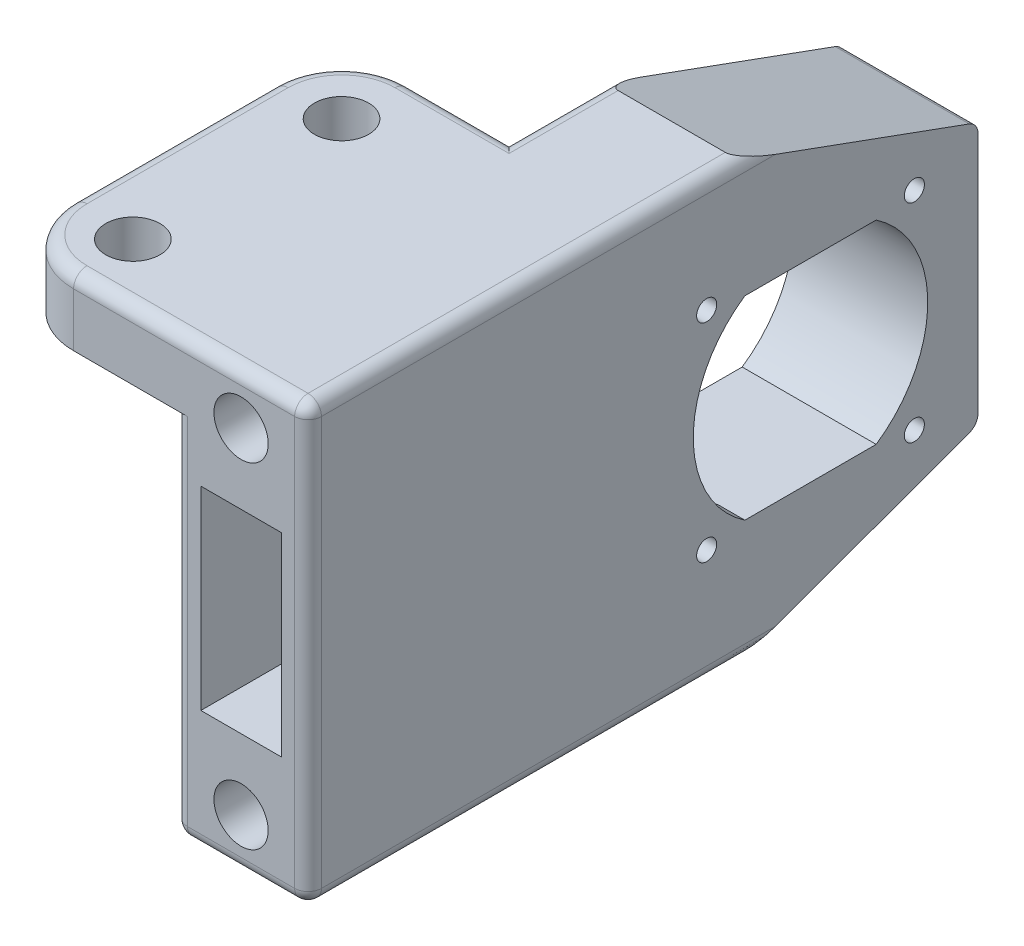
from build123d import *

# Parameters (mm, degrees)
SKETCH2_R               = 10
BOSS_EXTRUDE1_DEPTH     = 65
BOSS_EXTRUDE2_DEPTH     = 10
BOSS_EXTRUDE3_DEPTH     = 65
FILLET1_R               = 10
SKETCH5_R               = 4.05
CUT_EXTRUDE1_DEPTH      = 78.781745931
BOSS_EXTRUDE4_DEPTH     = 65
SKETCH8_R               = 4.05
CUT_EXTRUDE3_DEPTH      = 50
CUT_EXTRUDE5_DEPTH      = 92.923881554
CUT_EXTRUDE6_REACH      = 126.298
CUT_EXTRUDE6_END_RADIUS = 17.5
SKETCH7_W               = 12
SKETCH7_H               = 29
CHAMFER1_SIZE           = 13
CHAMFER1_SIZE2          = 35.717206453
FILLET2_R               = 2
SKETCH14_R              = 1.5
CUT_EXTRUDE7_DEPTH      = 100.247166206


with BuildPart() as part:
    # Sketch2 → Boss-Extrude1 (new body)
    with BuildSketch(Plane(origin=(0, 0, 0), x_dir=(1, 0, 0), z_dir=(0, 1, 0))):
        with Locations(Location((0, 0, 0), (0, 0, 270))):
            Circle(SKETCH2_R)
    extrude(amount=-BOSS_EXTRUDE1_DEPTH)

    # Sketch3 → Boss-Extrude2 (add)
    with BuildSketch(Plane(origin=(0, 0, 0), x_dir=(1, 0, 0), z_dir=(0, 1, 0))):
        with BuildLine():
            Line((-10, 0), (-10, -40))
            Line((-10, -40), (15, -40))
            Line((15, -40), (15, 10))
            Line((15, 10), (0, 10))
            ThreePointArc((0, 10), (-7.071067812, 7.071067812), (-10, 0))
        make_face()
    extrude(amount=-BOSS_EXTRUDE2_DEPTH)

    # Sketch4 → Boss-Extrude3 (add)
    with BuildSketch(Plane(origin=(0, 0, 0), x_dir=(1, 0, 0), z_dir=(0, 1, 0))):
        with BuildLine():
            Line((15, 10), (0, 10))
            ThreePointArc((0, 10), (10, 0), (0, -10))
            Line((0, -10), (15, -10))
            Line((15, -10), (15, 10))
        make_face()
    extrude(amount=-BOSS_EXTRUDE3_DEPTH)

    # Fillet1
    fillet1_edges = [part.edges().sort_by_distance(p)[0] for p in [
        (-10, -5, 40),
    ]]
    fillet(fillet1_edges, radius=FILLET1_R)

    # Sketch5 → Cut-Extrude1 (cut, through all)
    with BuildSketch(Plane(origin=(0, 0, 0), x_dir=(1, 0, 0), z_dir=(0, 1, 0))):
        with Locations(Location((0, -31.15, 0), (0, 0, 270))):
            Circle(SKETCH5_R)
        with Locations(Location((0, 0, 0), (0, 0, 270))):
            Circle(SKETCH5_R)
    extrude(amount=-CUT_EXTRUDE1_DEPTH, mode=Mode.SUBTRACT)

    # Sketch6 → Boss-Extrude4 (add)
    with BuildSketch(Plane(origin=(0, 0, 0), x_dir=(1, 0, 0), z_dir=(0, 1, 0))):
        Polygon((15, -40), (35, -40), (35, 60), (15, 60), (15, 10), align=None)
    extrude(amount=-BOSS_EXTRUDE4_DEPTH)

    # Sketch8 → Cut-Extrude3 (cut)
    with BuildSketch(Plane.XY.offset(40)):
        with Locations((25, -7.5)):
            Circle(SKETCH8_R)
        with Locations((25, -57.5)):
            Circle(SKETCH8_R)
    extrude(amount=-CUT_EXTRUDE3_DEPTH, mode=Mode.SUBTRACT)

    # Sketch13 → Cut-Extrude5 (cut, through all)
    with BuildSketch(Plane.ZY.offset(-15)):
        with BuildLine():
            Line((-44.797958971, -18), (-25.202041029, -18))
            ThreePointArc((-25.202041029, -18), (-17.5, -32.5), (-25.202041029, -47))
            Line((-25.202041029, -47), (-44.797958971, -47))
            ThreePointArc((-44.797958971, -47), (-52.5, -32.5), (-44.797958971, -18))
        make_face()
    extrude(amount=-CUT_EXTRUDE5_DEPTH, mode=Mode.SUBTRACT)

    # Cut-Extrude6: up to this cylinder (the profile starts outside it)
    cut_extrude6_end = Plane(origin=(25, -32.5, -35), z_dir=(-1, 0, 0)) * Cylinder(CUT_EXTRUDE6_END_RADIUS, 288.596, mode=Mode.PRIVATE)
    # Sketch7 → Cut-Extrude6 (cut, up to the surface)
    with BuildSketch(Plane.XY.offset(40), mode=Mode.PRIVATE) as cut_extrude6_sk1:
        with Locations((25, -32.5)):
            Rectangle(SKETCH7_W, SKETCH7_H)
    cut_extrude6_tool1 = extrude(cut_extrude6_sk1.sketch, amount=-CUT_EXTRUDE6_REACH, mode=Mode.PRIVATE) - cut_extrude6_end
    add(cut_extrude6_tool1.solids().sort_by_distance((25, -32.5, 40))[0], mode=Mode.SUBTRACT)

    # Chamfer1
    chamfer1_edges = [part.edges().sort_by_distance(p)[0] for p in [
        (25, 0, -60),
        (25, -65, -60),
    ]]
    chamfer1_side = [part.faces().sort_by_distance(p)[0] for p in [
        (25, -32.5, -60),
    ]]
    chamfer(chamfer1_edges, length=CHAMFER1_SIZE, length2=CHAMFER1_SIZE2, reference=chamfer1_side[0])

    # Fillet2
    fillet2_edges = [part.edges().sort_by_distance(p)[0] for p in [
        (7.5, 0, -10),
        (-10, 0, 15),
        (35, -65, 7.858603226),
        (25, -65, -24.282793547),
        (25, -13, -60),
        (25, -52, -60),
        (15, 0, -17.141396774),
        (-7.071067812, 0, -7.071067812),
        (-10, -65, 0),
        (7.5, -65, -10),
        (7.5, -65, 10),
        (17.5, 0, 40),
        (-7.071067812, 0, 37.071067812),
        (15, -37.5, 40),
        (35, -32.5, 40),
        (35, 0, 7.858603226),
        (15, -65, 25),
        (15, -65, -17.141396774),
        (25, -65, 40),
    ]]
    fillet(fillet2_edges, radius=FILLET2_R)

    # Sketch14 → Cut-Extrude7 (cut, through all)
    with BuildSketch(Plane(origin=(35, 0, 0), x_dir=(0, 0, -1), z_dir=(1, 0, 0))):
        with Locations((19.5, -17)):
            Circle(SKETCH14_R)
        with Locations((50.5, -17)):
            Circle(SKETCH14_R)
        with Locations((50.5, -48)):
            Circle(SKETCH14_R)
        with Locations((19.5, -48)):
            Circle(SKETCH14_R)
    extrude(amount=-CUT_EXTRUDE7_DEPTH, mode=Mode.SUBTRACT)


solid = part.part
